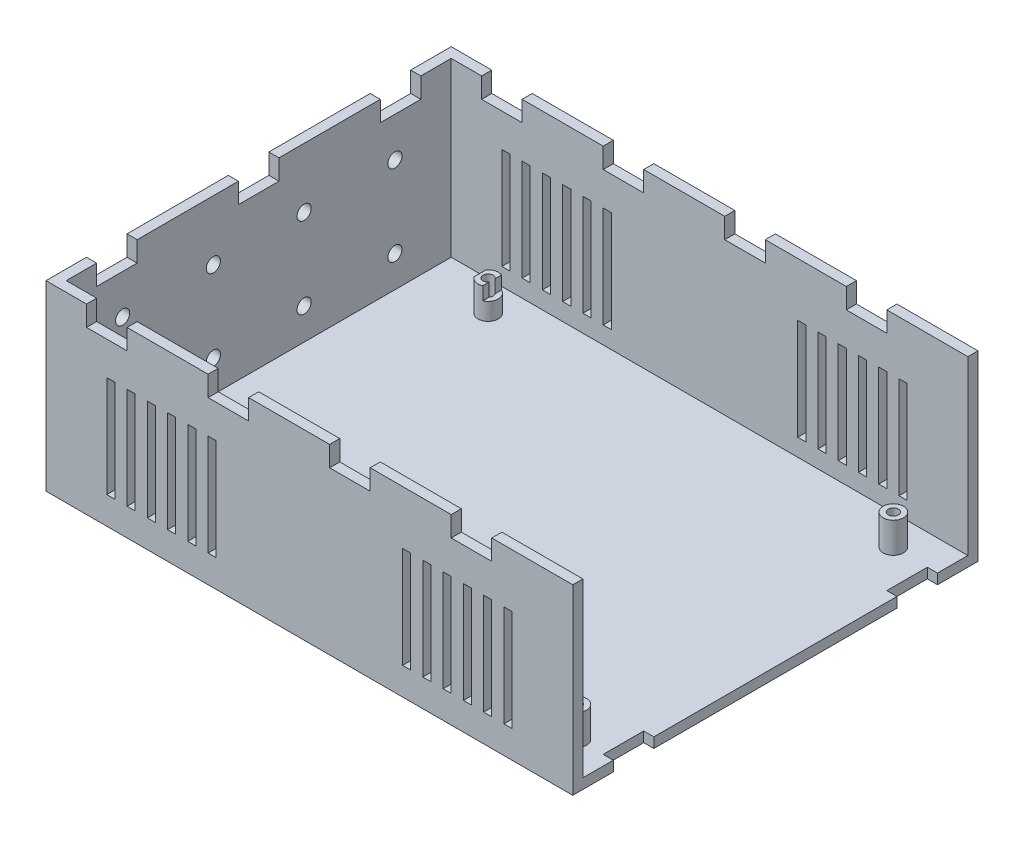
from build123d import *

# Parameters (mm, degrees)
SKETCH1_W               = 130
SKETCH1_H               = 100
BOSS_EXTRUDE2_DEPTH     = 45
SKETCH2_W               = 125
SKETCH2_H               = 95
CUT_EXTRUDE2_DEPTH      = 42.5
SKETCH3_W               = 95
SKETCH3_H               = 42.5
CUT_EXTRUDE3_DEPTH      = 30
SKETCH4_W               = 10
SKETCH4_H               = 5
CUT_EXTRUDE4_DEPTH      = 128.47548784
LPATTERN1_COUNT         = 4
LPATTERN1_PITCH         = 30
SKETCH5_W               = 10
SKETCH5_H               = 5
CUT_EXTRUDE5_DEPTH      = 147.372811683
LPATTERN2_COUNT         = 3
LPATTERN2_PITCH         = 35
SKETCH6_R               = 2.5
BOSS_EXTRUDE6_DEPTH     = 10
SKETCH8_R               = 1.25
CUT_EXTRUDE8_DEPTH      = 7.5
SKETCH10_R              = 1.75
CUT_EXTRUDE10_DEPTH     = 2.5
LPATTERN3_COUNT         = 4
LPATTERN3_PITCH         = 22.4
SKETCH11_W              = 10
SKETCH11_H              = 2.5
CUT_EXTRUDE11_DEPTH     = 2.5
SKETCH12_W              = 10
SKETCH12_H              = 2.5
CUT_EXTRUDE12_DEPTH     = 2.5
SKETCH13_W              = 2
SKETCH13_H              = 25
CUT_EXTRUDE13_DEPTH     = 128.47548784
LPATTERN4_COUNT         = 6
LPATTERN4_PITCH         = 5
MIRROR1_COPY_1_SKETCH_W = 2
MIRROR1_COPY_1_SKETCH_H = 25
MIRROR1_COPY_1_DEPTH    = 128.47548784
MIRROR1_COPY_2_SKETCH_W = 2
MIRROR1_COPY_2_SKETCH_H = 25
MIRROR1_COPY_2_DEPTH    = 128.47548784
MIRROR1_COPY_3_SKETCH_W = 2
MIRROR1_COPY_3_SKETCH_H = 25
MIRROR1_COPY_3_DEPTH    = 128.47548784
MIRROR1_COPY_4_SKETCH_W = 2
MIRROR1_COPY_4_SKETCH_H = 25
MIRROR1_COPY_4_DEPTH    = 128.47548784
MIRROR1_COPY_5_SKETCH_W = 2
MIRROR1_COPY_5_SKETCH_H = 25
MIRROR1_COPY_5_DEPTH    = 128.47548784


with BuildPart() as part:
    # Sketch1 → Boss-Extrude2 (new body)
    with BuildSketch(Plane(origin=(0, 0, 0), x_dir=(1, 0, 0), z_dir=(0, 1, 0))):
        Rectangle(SKETCH1_W, SKETCH1_H)
    extrude(amount=BOSS_EXTRUDE2_DEPTH)

    # Sketch2 → Cut-Extrude2 (cut)
    with BuildSketch(Plane(origin=(0, 45, 0), x_dir=(1, 0, 0), z_dir=(0, 1, 0))):
        Rectangle(SKETCH2_W, SKETCH2_H)
    extrude(amount=-CUT_EXTRUDE2_DEPTH, mode=Mode.SUBTRACT)

    # Sketch3 → Cut-Extrude3 (cut)
    with BuildSketch(Plane(origin=(65, 0, 0), x_dir=(0, 0, -1), z_dir=(1, 0, 0))):
        with Locations((0, 23.75)):
            Rectangle(SKETCH3_W, SKETCH3_H)
    extrude(amount=-CUT_EXTRUDE3_DEPTH, mode=Mode.SUBTRACT)

    # Sketch4 → Cut-Extrude4 (cut, through all)
    with BuildSketch(Plane.XY.offset(50)):
        with Locations((-50, 42.5)):
            Rectangle(SKETCH4_W, SKETCH4_H)
    cut_extrude4 = extrude(amount=-CUT_EXTRUDE4_DEPTH, mode=Mode.SUBTRACT)

    # LPattern1: Cut-Extrude4 ×4
    with Locations(*[(i * LPATTERN1_PITCH, 0, 0) for i in range(1, LPATTERN1_COUNT)]):
        add(cut_extrude4, mode=Mode.SUBTRACT)

    # Sketch5 → Cut-Extrude5 (cut, through all)
    with BuildSketch(Plane.ZY.offset(65)):
        with Locations((-35, 42.5)):
            Rectangle(SKETCH5_W, SKETCH5_H)
    cut_extrude5 = extrude(amount=-CUT_EXTRUDE5_DEPTH, mode=Mode.SUBTRACT)

    # LPattern2: Cut-Extrude5 ×3
    with Locations(*[(0, 0, i * LPATTERN2_PITCH) for i in range(1, LPATTERN2_COUNT)]):
        add(cut_extrude5, mode=Mode.SUBTRACT)

    # Sketch6 → Boss-Extrude6 (add)
    with BuildSketch(Plane.XZ):
        with Locations(Location((-46, -40.1, 0), (0, 0, 270))):
            Circle(SKETCH6_R)
        with Locations(Location((-46, 40.1, 0), (0, 0, 270))):
            Circle(SKETCH6_R)
        with Locations(Location((56, 40.1, 0), (0, 0, 270))):
            Circle(SKETCH6_R)
        with Locations(Location((54, -40.1, 0), (0, 0, 270))):
            Circle(SKETCH6_R)
    extrude(amount=-BOSS_EXTRUDE6_DEPTH)

    # Sketch8 → Cut-Extrude8 (cut)
    with BuildSketch(Plane(origin=(0, 10, 0), x_dir=(1, 0, 0), z_dir=(0, 1, 0))):
        with Locations(Location((56, -40.1, 0), (0, 0, 270))):
            Circle(SKETCH8_R)
        with Locations(Location((54, 40.1, 0), (0, 0, 270))):
            Circle(SKETCH8_R)
        with Locations(Location((-46, 40.1, 0), (0, 0, 270))):
            Circle(SKETCH8_R)
        with Locations(Location((-46, -40.1, 0), (0, 0, 270))):
            Circle(SKETCH8_R)
    extrude(amount=-CUT_EXTRUDE8_DEPTH, mode=Mode.SUBTRACT)

    # Sketch10 → Cut-Extrude10 (cut)
    with BuildSketch(Plane.ZY.offset(65)):
        with Locations((-33.6, 10.25)):
            Circle(SKETCH10_R)
        with Locations((-33.6, 30.25)):
            Circle(SKETCH10_R)
    cut_extrude10 = extrude(amount=-CUT_EXTRUDE10_DEPTH, mode=Mode.SUBTRACT)

    # LPattern3: Cut-Extrude10 ×4
    with Locations(*[(0, 0, i * LPATTERN3_PITCH) for i in range(1, LPATTERN3_COUNT)]):
        add(cut_extrude10, mode=Mode.SUBTRACT)

    # Sketch11 → Cut-Extrude11 (cut)
    with BuildSketch(Plane(origin=(65, 0, 0), x_dir=(0, 0, -1), z_dir=(1, 0, 0))):
        with Locations((-35, 1.25)):
            Rectangle(SKETCH11_W, SKETCH11_H)
    extrude(amount=-CUT_EXTRUDE11_DEPTH, mode=Mode.SUBTRACT)

    # Sketch12 → Cut-Extrude12 (cut)
    with BuildSketch(Plane(origin=(65, 0, 0), x_dir=(0, 0, -1), z_dir=(1, 0, 0))):
        with Locations((35, 1.25)):
            Rectangle(SKETCH12_W, SKETCH12_H)
    extrude(amount=-CUT_EXTRUDE12_DEPTH, mode=Mode.SUBTRACT)

    # Sketch13 → Cut-Extrude13 (cut, through all)
    with BuildSketch(Plane(origin=(0, 0, -50), x_dir=(-1, 0, 0), z_dir=(0, 0, -1))):
        with Locations((-49, 19.279479595)):
            Rectangle(SKETCH13_W, SKETCH13_H)
    cut_extrude13 = extrude(amount=-CUT_EXTRUDE13_DEPTH, mode=Mode.SUBTRACT)

    # LPattern4: Cut-Extrude13 ×6
    with Locations(*[(-i * LPATTERN4_PITCH, 0, 0) for i in range(1, LPATTERN4_COUNT)]):
        add(cut_extrude13, mode=Mode.SUBTRACT)

    # Mirror1: Cut-Extrude13 across plane
    add(cut_extrude13.mirror(Plane(origin=(0, 0, 0), x_dir=(0, 0, 1), z_dir=(1, 0, 0))), mode=Mode.SUBTRACT)

    # Mirror1 copy 1 sketch → Mirror1 copy 1 (cut, through all)
    with BuildSketch(Plane(origin=(5, 0, -50), x_dir=(1, 0, 0), z_dir=(0, 0, -1))):
        with Locations((-49, -19.279479595)):
            Rectangle(MIRROR1_COPY_1_SKETCH_W, MIRROR1_COPY_1_SKETCH_H)
    extrude(amount=-MIRROR1_COPY_1_DEPTH, mode=Mode.SUBTRACT)

    # Mirror1 copy 2 sketch → Mirror1 copy 2 (cut, through all)
    with BuildSketch(Plane(origin=(10, 0, -50), x_dir=(1, 0, 0), z_dir=(0, 0, -1))):
        with Locations((-49, -19.279479595)):
            Rectangle(MIRROR1_COPY_2_SKETCH_W, MIRROR1_COPY_2_SKETCH_H)
    extrude(amount=-MIRROR1_COPY_2_DEPTH, mode=Mode.SUBTRACT)

    # Mirror1 copy 3 sketch → Mirror1 copy 3 (cut, through all)
    with BuildSketch(Plane(origin=(15, 0, -50), x_dir=(1, 0, 0), z_dir=(0, 0, -1))):
        with Locations((-49, -19.279479595)):
            Rectangle(MIRROR1_COPY_3_SKETCH_W, MIRROR1_COPY_3_SKETCH_H)
    extrude(amount=-MIRROR1_COPY_3_DEPTH, mode=Mode.SUBTRACT)

    # Mirror1 copy 4 sketch → Mirror1 copy 4 (cut, through all)
    with BuildSketch(Plane(origin=(20, 0, -50), x_dir=(1, 0, 0), z_dir=(0, 0, -1))):
        with Locations((-49, -19.279479595)):
            Rectangle(MIRROR1_COPY_4_SKETCH_W, MIRROR1_COPY_4_SKETCH_H)
    extrude(amount=-MIRROR1_COPY_4_DEPTH, mode=Mode.SUBTRACT)

    # Mirror1 copy 5 sketch → Mirror1 copy 5 (cut, through all)
    with BuildSketch(Plane(origin=(25, 0, -50), x_dir=(1, 0, 0), z_dir=(0, 0, -1))):
        with Locations((-49, -19.279479595)):
            Rectangle(MIRROR1_COPY_5_SKETCH_W, MIRROR1_COPY_5_SKETCH_H)
    extrude(amount=-MIRROR1_COPY_5_DEPTH, mode=Mode.SUBTRACT)


solid = part.part
